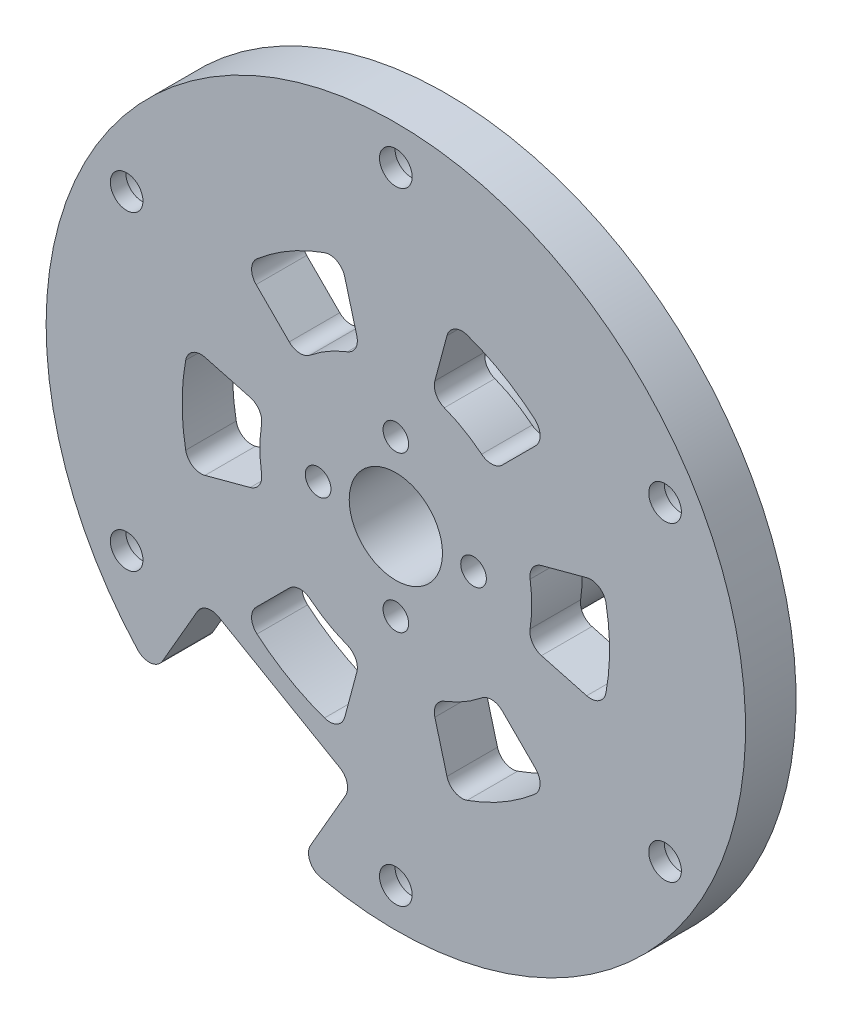
from build123d import *

# Parameters (mm, degrees)
SKETCH_1_R               = 45
EXTRUDE_1_DEPTH          = 6
SKETCH_2_R               = 34.65
SKETCH_2_R_2             = 2
CUT_EXTRUDE_1_DEPTH      = 64.921827258
EXTRUDE_START            = -3.5
SKETCH_4_R               = 34.65
EXTRUDE_3_DEPTH          = 3.5
SKETCH_5_R               = 15
EXTRUDE_4_DEPTH          = 17
SKETCH_6_R               = 3.75
CUT_EXTRUDE_2_DEPTH      = 4
PATTERN_CIRCULAR_1_COUNT = 6
CUT_EXTRUDE_4_DEPTH      = 66.871086221
CUT_EXTRUDE_5_DEPTH      = 2.5
EXTRUDE_6_DEPTH          = 3
SKETCH_13_R              = 2.1
CUT_EXTRUDE_6_DEPTH      = 5
SKETCH_14_R              = 3.75
CUT_EXTRUDE_7_DEPTH      = 1
HOLE_WIZARD_M4_1_D       = 3.3
FILLET_1_R               = 2
CUT_EXTRUDE_8_DEPTH      = 10
FILLET_2_R               = 2
SKETCH_21_R              = 6
CUT_EXTRUDE_9_DEPTH      = 68


with BuildPart() as part:
    # 草图1 → 凸台-拉伸1 (new body)
    with BuildSketch(Plane.XY):
        Circle(SKETCH_1_R)
    extrude(amount=EXTRUDE_1_DEPTH)

    # 草图2 → 切除-拉伸1 (cut, through all)
    with BuildSketch(Plane.XY.offset(6)):
        Circle(SKETCH_2_R)
        with Locations((0, 40)):
            Circle(SKETCH_2_R_2)
        with Locations((34.641016151, 20)):
            Circle(SKETCH_2_R_2)
        with Locations((34.641016151, -20)):
            Circle(SKETCH_2_R_2)
        with Locations((0, -40)):
            Circle(SKETCH_2_R_2)
        with Locations((-34.641016151, -20)):
            Circle(SKETCH_2_R_2)
        with Locations((-34.641016151, 20)):
            Circle(SKETCH_2_R_2)
    extrude(amount=-CUT_EXTRUDE_1_DEPTH, mode=Mode.SUBTRACT)

    # 草图4 → 凸台-拉伸3 (add)
    with BuildSketch(Plane(origin=(0, 0, 0), x_dir=(-1, 0, 0), z_dir=(0, 0, -1)).offset(EXTRUDE_START)):
        with Locations(Location((0, 0, 0), (0, 0, 180))):
            Circle(SKETCH_4_R)
    extrude(amount=EXTRUDE_3_DEPTH)

    # 草图5 → 凸台-拉伸4 (add)
    with BuildSketch(Plane(origin=(0, 0, 0), x_dir=(-1, 0, 0), z_dir=(0, 0, -1))):
        with Locations(Location((0, 0, 0), (0, 0, 180))):
            Circle(SKETCH_5_R)
    extrude(amount=EXTRUDE_4_DEPTH)

    # 草图6 → 切除-拉伸2 (cut)
    with BuildSketch(Plane(origin=(0, 0, 0), x_dir=(-1, 0, 0), z_dir=(0, 0, -1))):
        with Locations((0, 40)):
            Circle(SKETCH_6_R)
    cut_extrude_2 = extrude(amount=-CUT_EXTRUDE_2_DEPTH, mode=Mode.SUBTRACT)

    # 阵列(圆周)1: 切除-拉伸2 ×6 about axis
    pattern_circular_1_axis = Axis((0, 0, 0), (0, 0, 1))
    for i in range(1, PATTERN_CIRCULAR_1_COUNT):
        add(cut_extrude_2.rotate(pattern_circular_1_axis, i * 360 / PATTERN_CIRCULAR_1_COUNT), mode=Mode.SUBTRACT)

    # 草图9 → 切除-拉伸4 (cut, through all)
    with BuildSketch(Plane(origin=(0, 0, 0), x_dir=(-1, 0, 0), z_dir=(0, 0, -1))):
        Polygon((24.526279442, -20.480762114), (42.026279442, -50.791651246), (22.973720558, -61.791651246), (5.473720558, -31.480762114), align=None)
    extrude(amount=-CUT_EXTRUDE_4_DEPTH, mode=Mode.SUBTRACT)

    # 草图11 → 切除-拉伸5 (cut)
    with BuildSketch(Plane.XY.offset(6)):
        with BuildLine():
            Line((-31.343703671, -32.288887255), (-25.955084176, -22.955524508))
            ThreePointArc((-25.955084176, -22.955524508), (17.325, 30.007780241), (-6.902525293, -33.955524508))
            Line((-6.902525293, -33.955524508), (-12.291144788, -43.288887255))
            ThreePointArc((-12.291144788, -43.288887255), (22.5, 38.97114317), (-31.343703671, -32.288887255))
        make_face()
    extrude(amount=-CUT_EXTRUDE_5_DEPTH, mode=Mode.SUBTRACT)

    # 草图12 → 凸台-拉伸6 (add)
    with BuildSketch(Plane.XY.offset(3.5)):
        with BuildLine():
            Line((-5.473720558, -31.480762114), (-12.291144788, -43.288887255))
            ThreePointArc((-12.291144788, -43.288887255), (22.5, 38.97114317), (-31.343703671, -32.288887255))
            Line((-31.343703671, -32.288887255), (-24.526279442, -20.480762114))
            Line((-24.526279442, -20.480762114), (-5.473720558, -31.480762114))
        make_face()
    extrude(amount=EXTRUDE_6_DEPTH)

    # 草图13 → 切除-拉伸6 (cut)
    with BuildSketch(Plane.XY.offset(6.5)):
        with Locations((0, 40)):
            Circle(SKETCH_13_R)
        with Locations((34.641016151, 20)):
            Circle(SKETCH_13_R)
        with Locations((34.641016151, -20)):
            Circle(SKETCH_13_R)
        with Locations((0, -40)):
            Circle(SKETCH_13_R)
        with Locations((-34.641016151, -20)):
            Circle(SKETCH_13_R)
        with Locations((-34.641016151, 20)):
            Circle(SKETCH_13_R)
    extrude(amount=-CUT_EXTRUDE_6_DEPTH, mode=Mode.SUBTRACT)

    # 草图14 → 切除-拉伸7 (cut)
    with BuildSketch(Plane(origin=(0, 0, 3.5), x_dir=(-1, 0, 0), z_dir=(0, 0, -1))):
        with Locations((0, 40)):
            Circle(SKETCH_14_R)
        with Locations((-34.641016151, 20)):
            Circle(SKETCH_14_R)
        with Locations((34.641016151, 20)):
            Circle(SKETCH_14_R)
        with Locations((34.641016151, -20)):
            Circle(SKETCH_14_R)
        with Locations((0, -40)):
            Circle(SKETCH_14_R)
        with Locations((-34.641016151, -20)):
            Circle(SKETCH_14_R)
    extrude(amount=-CUT_EXTRUDE_7_DEPTH, mode=Mode.SUBTRACT)

    # M4 螺纹孔1 (through all)
    with Locations(Plane(origin=(0, 10, -17), x_dir=(-1, 0, 0), z_dir=(0, 0, -1))):
        with Locations((0, 0), (10, -10), (0, -20), (-10, -10)):
            Hole(HOLE_WIZARD_M4_1_D / 2)

    # 圆角1
    fillet_1_edges = [part.edges().sort_by_distance(p)[0] for p in [
        (-12.291144788, -43.288887255, 3.25),
        (-5.473720558, -31.480762114, 3.25),
        (-31.343703671, -32.288887255, 3.25),
        (-24.526279442, -20.480762114, 3.25),
    ]]
    fillet(fillet_1_edges, radius=FILLET_1_R)

    # 草图20 → 切除-拉伸8 (cut)
    with BuildSketch(Plane(origin=(0, 0, 0), x_dir=(-1, 0, 0), z_dir=(0, 0, -1))):
        with BuildLine():
            Line((-4.529333289, 16.90370196), (-7.11752374, 26.562960223))
            ThreePointArc((-7.11752374, 26.562960223), (-13.75, 23.815698604), (-19.445436483, 19.445436483))
            Line((-19.445436483, 19.445436483), (-12.374368671, 12.374368671))
            ThreePointArc((-12.374368671, 12.374368671), (-8.75, 15.155444566), (-4.529333289, 16.90370196))
        make_face()
        with BuildLine():
            Line((12.374368671, 12.374368671), (19.445436483, 19.445436483))
            ThreePointArc((19.445436483, 19.445436483), (13.75, 23.815698604), (7.11752374, 26.562960223))
            Line((7.11752374, 26.562960223), (4.529333289, 16.90370196))
            ThreePointArc((4.529333289, 16.90370196), (8.75, 15.155444566), (12.374368671, 12.374368671))
        make_face()
        with BuildLine():
            Line((16.90370196, -4.529333289), (26.562960223, -7.11752374))
            ThreePointArc((26.562960223, -7.11752374), (27.5, 0), (26.562960223, 7.11752374))
            Line((26.562960223, 7.11752374), (16.90370196, 4.529333289))
            ThreePointArc((16.90370196, 4.529333289), (17.5, 0), (16.90370196, -4.529333289))
        make_face()
        with BuildLine():
            Line((4.529333289, -16.90370196), (7.11752374, -26.562960223))
            ThreePointArc((7.11752374, -26.562960223), (13.75, -23.815698604), (19.445436483, -19.445436483))
            Line((19.445436483, -19.445436483), (12.374368671, -12.374368671))
            ThreePointArc((12.374368671, -12.374368671), (8.75, -15.155444566), (4.529333289, -16.90370196))
        make_face()
        with BuildLine():
            Line((-12.374368671, -12.374368671), (-19.445436483, -19.445436483))
            ThreePointArc((-19.445436483, -19.445436483), (-13.75, -23.815698604), (-7.11752374, -26.562960223))
            Line((-7.11752374, -26.562960223), (-4.529333289, -16.90370196))
            ThreePointArc((-4.529333289, -16.90370196), (-8.75, -15.155444566), (-12.374368671, -12.374368671))
        make_face()
        with BuildLine():
            Line((-16.90370196, 4.529333289), (-26.562960223, 7.11752374))
            ThreePointArc((-26.562960223, 7.11752374), (-27.5, 0), (-26.562960223, -7.11752374))
            Line((-26.562960223, -7.11752374), (-16.90370196, -4.529333289))
            ThreePointArc((-16.90370196, -4.529333289), (-17.5, 0), (-16.90370196, 4.529333289))
        make_face()
    extrude(amount=-CUT_EXTRUDE_8_DEPTH, mode=Mode.SUBTRACT)

    # 圆角2
    fillet_2_edges = [part.edges().sort_by_distance(p)[0] for p in [
        (-12.374368671, 12.374368671, 3.25),
        (-4.529333289, 16.90370196, 3.25),
        (-7.11752374, 26.562960223, 3.25),
        (-19.445436483, 19.445436483, 3.25),
        (-16.90370196, -4.529333289, 3.25),
        (-16.90370196, 4.529333289, 3.25),
        (-26.562960223, 7.11752374, 3.25),
        (-26.562960223, -7.11752374, 3.25),
        (-4.529333289, -16.90370196, 3.25),
        (-12.374368671, -12.374368671, 3.25),
        (-19.445436483, -19.445436483, 3.25),
        (-7.11752374, -26.562960223, 3.25),
        (12.374368671, -12.374368671, 3.25),
        (4.529333289, -16.90370196, 3.25),
        (7.11752374, -26.562960223, 3.25),
        (19.445436483, -19.445436483, 3.25),
        (16.90370196, 4.529333289, 3.25),
        (16.90370196, -4.529333289, 3.25),
        (26.562960223, -7.11752374, 3.25),
        (26.562960223, 7.11752374, 3.25),
        (4.529333289, 16.90370196, 3.25),
        (12.374368671, 12.374368671, 3.25),
        (19.445436483, 19.445436483, 3.25),
        (7.11752374, 26.562960223, 3.25),
    ]]
    fillet(fillet_2_edges, radius=FILLET_2_R)

    # 草图21 → 切除-拉伸9 (cut)
    with BuildSketch(Plane(origin=(0, 0, -17), x_dir=(-1, 0, 0), z_dir=(0, 0, -1))):
        Circle(SKETCH_21_R)
    extrude(amount=-CUT_EXTRUDE_9_DEPTH, mode=Mode.SUBTRACT)


solid = part.part
